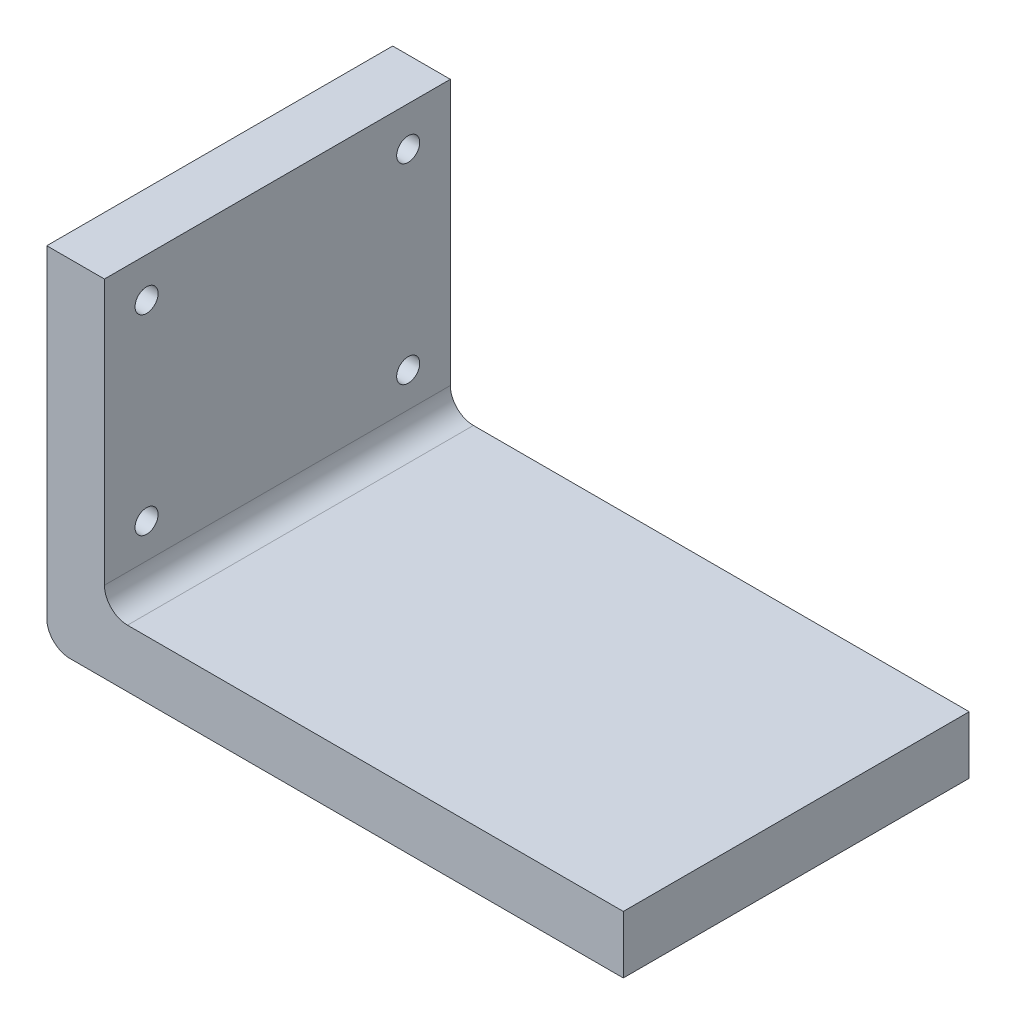
from build123d import *

# Parameters (mm, degrees)
BOSS_EXTRUDE1_DEPTH = 76.2
SKETCH4_R           = 2.54
CUT_EXTRUDE2_DEPTH  = 76.2


with BuildPart() as part:
    # Sketch1 → Boss-Extrude1 (new body)
    with BuildSketch(Plane.XY):
        with BuildLine():
            Line((0, 5.08), (0, 76.2))
            Line((0, 76.2), (12.7, 76.2))
            Line((12.7, 76.2), (12.7, 17.78))
            ThreePointArc((12.7, 17.78), (14.187897552, 14.187897552), (17.78, 12.7))
            Line((17.78, 12.7), (127, 12.7))
            Line((127, 12.7), (127, 0))
            Line((127, 0), (5.08, 0))
            ThreePointArc((5.08, 0), (1.487897552, 1.487897552), (0, 5.08))
        make_face()
    extrude(amount=BOSS_EXTRUDE1_DEPTH)

    # Sketch4 → Cut-Extrude2 (cut)
    with BuildSketch(Plane.ZY):
        with Locations((9.284401907, 67.53455822)):
            Circle(SKETCH4_R)
        with Locations((66.915598093, 67.53455822)):
            Circle(SKETCH4_R)
        with Locations((66.915598093, 25.4)):
            Circle(SKETCH4_R)
        with Locations((9.284401907, 25.4)):
            Circle(SKETCH4_R)
    extrude(amount=-CUT_EXTRUDE2_DEPTH, mode=Mode.SUBTRACT)


solid = part.part
